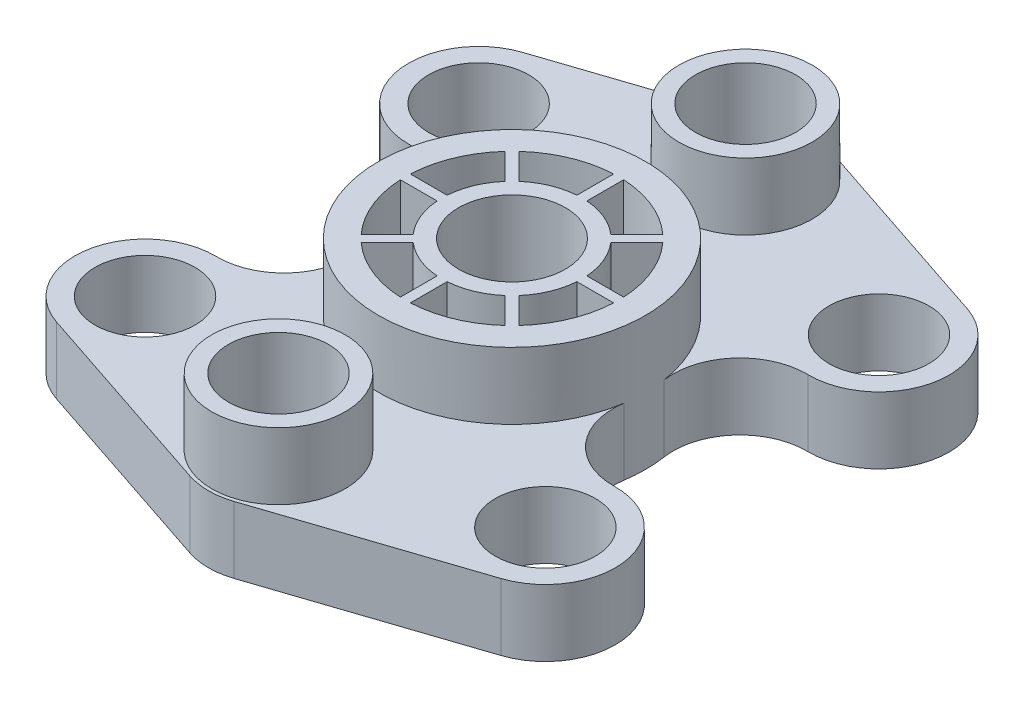
from build123d import *
from build123d.topology import SkipClean

# Parameters (mm, degrees)
BOSS_EXTRUDE2_DEPTH = 20
SKETCH2_R           = 40
SKETCH2_R_2         = 20
BOSS_EXTRUDE3_DEPTH = 20
SKETCH2_5_R         = 15
CUT_EXTRUDE1_DEPTH  = 20
SKETCH3_R           = 16
CUT_EXTRUDE2_DEPTH  = 129.226362344
SKETCH4_R           = 15
CUT_EXTRUDE3_DEPTH  = 129.226362344


with BuildPart() as part:
    # Sketch1 → Boss-Extrude2 (new body)
    with BuildSketch(Plane(origin=(0, 0, 0), x_dir=(1, 0, 0), z_dir=(0, 1, 0))):
        with BuildLine():
            Line((-66.640783086, 69.922349259), (-6.640783086, 89.922349259))
            ThreePointArc((-6.640783086, 89.922349259), (0, 91), (6.640783086, 89.922349259))
            Line((6.640783086, 89.922349259), (66.640783086, 69.922349259))
            ThreePointArc((66.640783086, 69.922349259), (80.700240831, 46.464461919), (59.651863383, 29.002885891))
            ThreePointArc((59.651863383, 29.002885891), (44.262528341, 22.168588856), (39.546869801, 6.003756239))
            ThreePointArc((39.546869801, 6.003756239), (40, 0), (39.546869801, -6.003756239))
            ThreePointArc((39.546869801, -6.003756239), (44.262528341, -22.168588856), (59.651863383, -29.002885891))
            ThreePointArc((59.651863383, -29.002885891), (80.700240831, -46.464461919), (66.640783086, -69.922349259))
            Line((66.640783086, -69.922349259), (6.640783086, -89.922349259))
            ThreePointArc((6.640783086, -89.922349259), (0, -91), (-6.640783086, -89.922349259))
            Line((-6.640783086, -89.922349259), (-66.640783086, -69.922349259))
            ThreePointArc((-66.640783086, -69.922349259), (-80.700240831, -46.464461919), (-59.651863383, -29.002885891))
            ThreePointArc((-59.651863383, -29.002885891), (-44.262528341, -22.168588856), (-39.546869801, -6.003756239))
            ThreePointArc((-39.546869801, -6.003756239), (-40, 0), (-39.546869801, 6.003756239))
            ThreePointArc((-39.546869801, 6.003756239), (-44.262528341, 22.168588856), (-59.651863383, 29.002885891))
            ThreePointArc((-59.651863383, 29.002885891), (-80.700240831, 46.464461919), (-66.640783086, 69.922349259))
        make_face()
    extrude(amount=BOSS_EXTRUDE2_DEPTH)

    # Sketch2 → Boss-Extrude3 (add)
    with SkipClean():  # the faces are left unmerged after this step: merging them gives an invalid solid
        with BuildSketch(Plane(origin=(0, 20, 0), x_dir=(1, 0, 0), z_dir=(0, 1, 0))):
            Circle(SKETCH2_R)
            with Locations((0, 70)):
                Circle(SKETCH2_R_2)
            with Locations((0, -70)):
                Circle(SKETCH2_R_2)
        extrude(amount=BOSS_EXTRUDE3_DEPTH)

    # Sketch2<5> → Cut-Extrude1 (cut)
    with SkipClean():  # the faces are left unmerged after this step: merging them gives an invalid solid
        with BuildSketch(Plane(origin=(0, 20, 0), x_dir=(1, 0, 0), z_dir=(0, 1, 0))):
            with Locations((60, 50)):
                Circle(SKETCH2_5_R)
            with Locations((-60, 50)):
                Circle(SKETCH2_5_R)
            with Locations((60, -50)):
                Circle(SKETCH2_5_R)
            with Locations((-60, -50)):
                Circle(SKETCH2_5_R)
        extrude(amount=-CUT_EXTRUDE1_DEPTH, mode=Mode.SUBTRACT)

    # Sketch3 → Cut-Extrude2 (cut, through all)
    with SkipClean():  # the faces are left unmerged after this step: merging them gives an invalid solid
        with BuildSketch(Plane(origin=(0, 40, 0), x_dir=(1, 0, 0), z_dir=(0, 1, 0))):
            Circle(SKETCH3_R)
            with BuildLine():
                Line((-1.5, 31.964824417), (-1.5, 20.946360066))
                ThreePointArc((-1.5, 20.946360066), (-8.03635208, 19.401470183), (-13.750653072, 15.871973415))
                Line((-13.750653072, 15.871973415), (-21.541883933, 23.663204276))
                ThreePointArc((-21.541883933, 23.663204276), (-12.245869836, 29.56414504), (-1.5, 31.964824417))
            make_face()
            with BuildLine():
                Line((1.5, 31.964824417), (1.5, 20.946360066))
                ThreePointArc((1.5, 20.946360066), (8.03635208, 19.401470183), (13.750653072, 15.871973415))
                Line((13.750653072, 15.871973415), (21.541883933, 23.663204276))
                ThreePointArc((21.541883933, 23.663204276), (12.245869836, 29.56414504), (1.5, 31.964824417))
            make_face()
            with BuildLine():
                Line((23.663204276, 21.541883933), (15.871973415, 13.750653072))
                ThreePointArc((15.871973415, 13.750653072), (19.401470183, 8.03635208), (20.946360066, 1.5))
                Line((20.946360066, 1.5), (31.964824417, 1.5))
                ThreePointArc((31.964824417, 1.5), (29.56414504, 12.245869836), (23.663204276, 21.541883933))
            make_face()
            with BuildLine():
                Line((31.964824417, -1.5), (20.946360066, -1.5))
                ThreePointArc((20.946360066, -1.5), (19.401470183, -8.03635208), (15.871973415, -13.750653072))
                Line((15.871973415, -13.750653072), (23.663204276, -21.541883933))
                ThreePointArc((23.663204276, -21.541883933), (29.56414504, -12.245869836), (31.964824417, -1.5))
            make_face()
            with BuildLine():
                Line((21.541883933, -23.663204276), (13.750653072, -15.871973415))
                ThreePointArc((13.750653072, -15.871973415), (8.03635208, -19.401470183), (1.5, -20.946360066))
                Line((1.5, -20.946360066), (1.5, -31.964824417))
                ThreePointArc((1.5, -31.964824417), (12.245869836, -29.56414504), (21.541883933, -23.663204276))
            make_face()
            with BuildLine():
                Line((-1.5, -31.964824417), (-1.5, -20.946360066))
                ThreePointArc((-1.5, -20.946360066), (-8.03635208, -19.401470183), (-13.750653072, -15.871973415))
                Line((-13.750653072, -15.871973415), (-21.541883933, -23.663204276))
                ThreePointArc((-21.541883933, -23.663204276), (-12.245869836, -29.56414504), (-1.5, -31.964824417))
            make_face()
            with BuildLine():
                Line((-23.663204276, -21.541883933), (-15.871973415, -13.750653072))
                ThreePointArc((-15.871973415, -13.750653072), (-19.401470183, -8.03635208), (-20.946360066, -1.5))
                Line((-20.946360066, -1.5), (-31.964824417, -1.5))
                ThreePointArc((-31.964824417, -1.5), (-29.56414504, -12.245869836), (-23.663204276, -21.541883933))
            make_face()
            with BuildLine():
                Line((-31.964824417, 1.5), (-20.946360066, 1.5))
                ThreePointArc((-20.946360066, 1.5), (-19.401470183, 8.03635208), (-15.871973415, 13.750653072))
                Line((-15.871973415, 13.750653072), (-23.663204276, 21.541883933))
                ThreePointArc((-23.663204276, 21.541883933), (-29.56414504, 12.245869836), (-31.964824417, 1.5))
            make_face()
        extrude(amount=-CUT_EXTRUDE2_DEPTH, mode=Mode.SUBTRACT)

    # Sketch4 → Cut-Extrude3 (cut, through all)
    with SkipClean():  # the faces are left unmerged after this step: merging them gives an invalid solid
        with BuildSketch(Plane(origin=(0, 40, 0), x_dir=(1, 0, 0), z_dir=(0, 1, 0))):
            with Locations((0, 70)):
                Circle(SKETCH4_R)
            with Locations((0, -70)):
                Circle(SKETCH4_R)
        extrude(amount=-CUT_EXTRUDE3_DEPTH, mode=Mode.SUBTRACT)


solid = part.part
